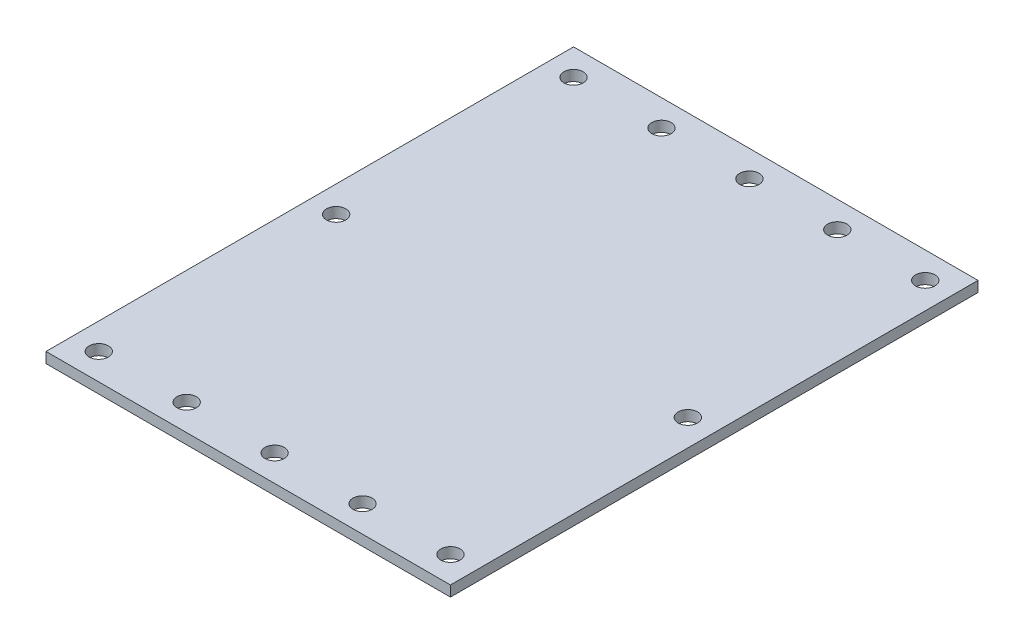
from build123d import *

# Parameters (mm, degrees)
SKETCH1_W           = 230
SKETCH1_H           = 300
SKETCH1_R           = 5.5
BOSS_EXTRUDE1_DEPTH = 6


with BuildPart() as part:
    # Sketch1 → Boss-Extrude1 (new body)
    with BuildSketch(Plane(origin=(0, 0, 0), x_dir=(1, 0, 0), z_dir=(0, 1, 0))):
        with Locations((115, 150)):
            Rectangle(SKETCH1_W, SKETCH1_H)
        with Locations((15, 15)):
            Circle(SKETCH1_R, mode=Mode.SUBTRACT)
        with Locations((15, 285)):
            Circle(SKETCH1_R, mode=Mode.SUBTRACT)
        with Locations((15, 150)):
            Circle(SKETCH1_R, mode=Mode.SUBTRACT)
        with Locations((215, 15)):
            Circle(SKETCH1_R, mode=Mode.SUBTRACT)
        with Locations((215, 150)):
            Circle(SKETCH1_R, mode=Mode.SUBTRACT)
        with Locations((215, 285)):
            Circle(SKETCH1_R, mode=Mode.SUBTRACT)
        with Locations((165, 15)):
            Circle(SKETCH1_R, mode=Mode.SUBTRACT)
        with Locations((115, 15)):
            Circle(SKETCH1_R, mode=Mode.SUBTRACT)
        with Locations((65, 15)):
            Circle(SKETCH1_R, mode=Mode.SUBTRACT)
        with Locations((165, 285)):
            Circle(SKETCH1_R, mode=Mode.SUBTRACT)
        with Locations((115, 285)):
            Circle(SKETCH1_R, mode=Mode.SUBTRACT)
        with Locations((65, 285)):
            Circle(SKETCH1_R, mode=Mode.SUBTRACT)
    extrude(amount=BOSS_EXTRUDE1_DEPTH)


solid = part.part
